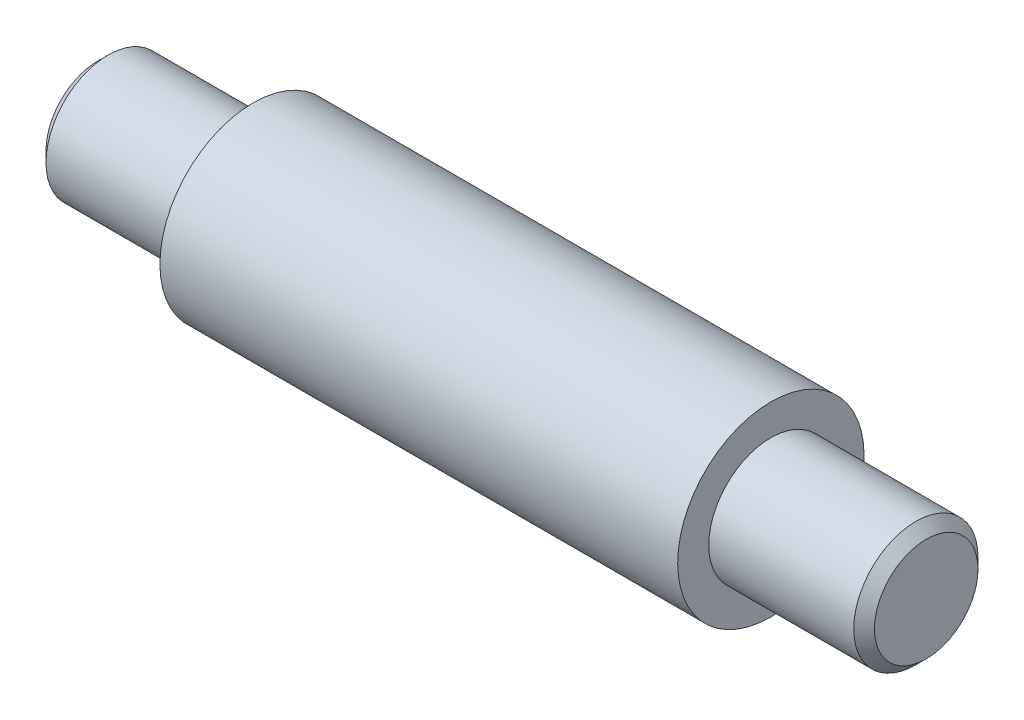
from build123d import *

# Parameters (mm, degrees)
CHAMFER1_SIZE = 1


with BuildPart() as part:
    # Sketch1 → Revolve1 (revolve)
    with BuildSketch(Plane.XY, mode=Mode.PRIVATE) as revolve1_sk:
        Polygon((-40, 0), (40, 0), (40, 6), (25, 6), (25, 9), (-25, 9), (-25, 6), (-40, 6), align=None)
    revolve(revolve1_sk.sketch.rotate(Axis((-40, 0, 0), (1, 0, 0)), 90), axis=Axis((-40, 0, 0), (1, 0, 0)))

    # Chamfer1
    chamfer1_edges = [part.edges().sort_by_distance(p)[0] for p in [
        (-40, 0, -6),
        (40, 0, -6),
    ]]
    chamfer(chamfer1_edges, length=CHAMFER1_SIZE)


solid = part.part
